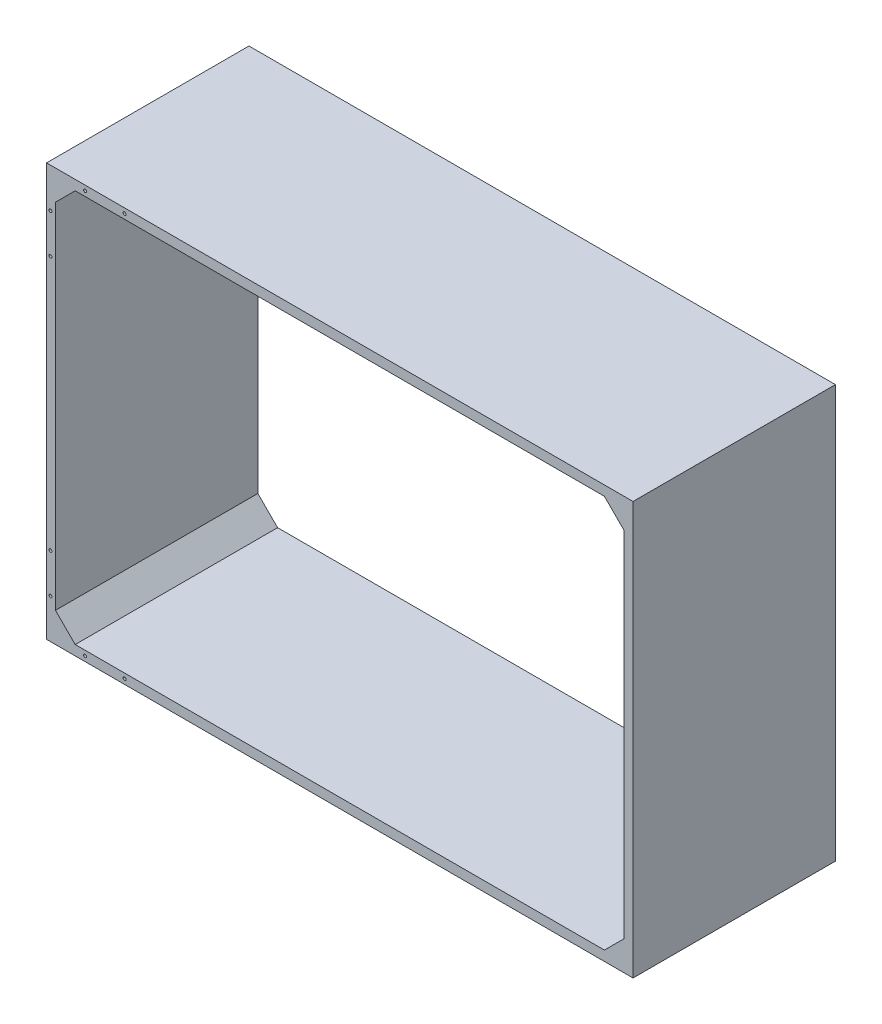
from build123d import *

# Parameters (mm, degrees)
SKETCH_1_W                = 594
SKETCH_1_H                = 418
EXTRUDE_1_DEPTH           = 205
SKETCH_2_W                = 576
SKETCH_2_H                = 398
CUT_EXTRUDE_1_DEPTH       = 418.031173895
HOLE_WIZARD_3_0_3_1_D     = 3
HOLE_WIZARD_3_0_3_1_DEPTH = 14.098709071
HOLE_WIZARD_3_0_3_1_TIP   = 0.901290929
CHAMFER_1_SIZE            = 20


with BuildPart() as part:
    # Эскиз1 → Бобышка-Вытянуть1 (new body)
    with BuildSketch(Plane(origin=(0, 0, -205), x_dir=(-1, 0, 0), z_dir=(0, 0, -1))):
        Rectangle(SKETCH_1_W, SKETCH_1_H)
    extrude(amount=-EXTRUDE_1_DEPTH)

    # Эскиз2 → Вырез-Вытянуть1 (cut, through all)
    with BuildSketch(Plane.XY):
        Rectangle(SKETCH_2_W, SKETCH_2_H)
    extrude(amount=-CUT_EXTRUDE_1_DEPTH, mode=Mode.SUBTRACT)

    # Диаметр отверстия Ø3.0 (3)1
    with Locations(Plane.XY):
        with Locations((-293, -169), (-293, -129), (-258, 204), (-293, 169), (-293, 129), (-218, 204), (-258, -204), (-218, -204)):
            Hole(HOLE_WIZARD_3_0_3_1_D / 2, depth=HOLE_WIZARD_3_0_3_1_DEPTH)
            with Locations((0, 0, -(HOLE_WIZARD_3_0_3_1_DEPTH + HOLE_WIZARD_3_0_3_1_TIP / 2))):  # 118° drill point
                Cone(0, HOLE_WIZARD_3_0_3_1_D / 2, HOLE_WIZARD_3_0_3_1_TIP, mode=Mode.SUBTRACT)

    # Фаска1
    chamfer_1_edges = [part.edges().sort_by_distance(p)[0] for p in [
        (288, 199, -102.5),
        (288, -199, -102.5),
        (-288, -199, -102.5),
        (-288, 199, -102.5),
    ]]
    chamfer(chamfer_1_edges, length=CHAMFER_1_SIZE)


solid = part.part
